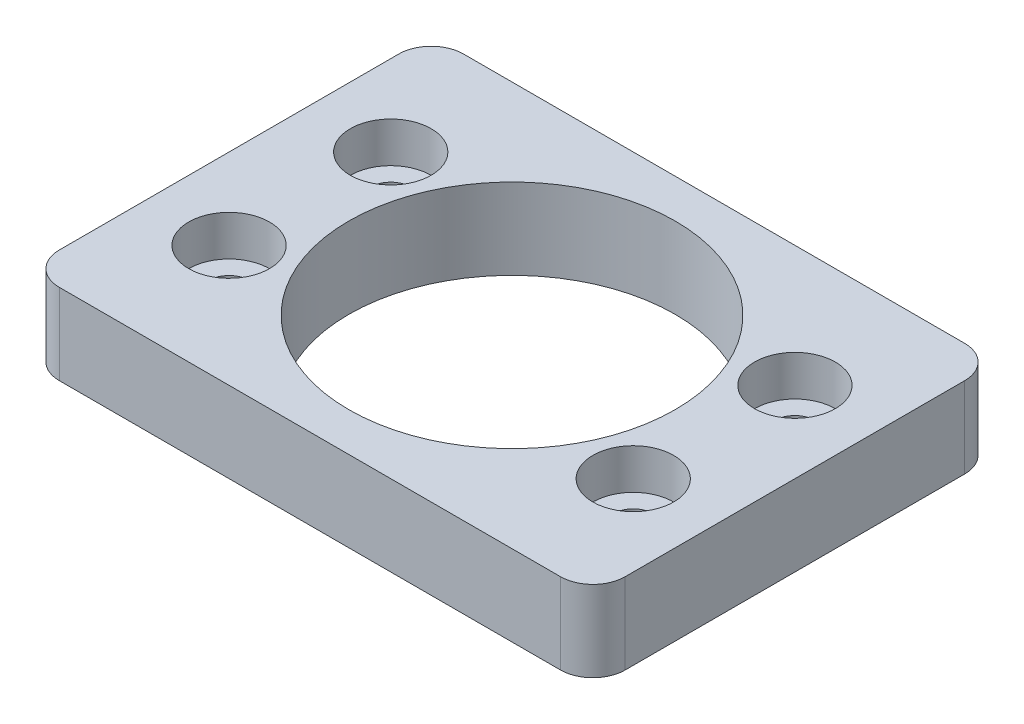
from build123d import *

# Parameters (mm, degrees)
SKETCH1_W           = 88.9
SKETCH1_H           = 63.5
SKETCH1_R           = 25.654
SKETCH1_R_2         = 3.175
BOSS_EXTRUDE1_DEPTH = 12.7
FILLET1_R           = 5.08
SKETCH2_R           = 6.35
CUT_EXTRUDE1_DEPTH  = 6.35


with BuildPart() as part:
    # Sketch1 → Boss-Extrude1 (new body)
    with BuildSketch(Plane(origin=(0, 0, 0), x_dir=(1, 0, 0), z_dir=(0, 1, 0))):
        Rectangle(SKETCH1_W, SKETCH1_H)
        with Locations(Location((0, 0, 0), (0, 0, 270))):
            Circle(SKETCH1_R, mode=Mode.SUBTRACT)
        with Locations(Location((-31.75, 12.7, 0), (0, 0, 270))):
            Circle(SKETCH1_R_2, mode=Mode.SUBTRACT)
        with Locations(Location((-31.75, -12.7, 0), (0, 0, 270))):
            Circle(SKETCH1_R_2, mode=Mode.SUBTRACT)
        with Locations(Location((31.75, -12.7, 0), (0, 0, 270))):
            Circle(SKETCH1_R_2, mode=Mode.SUBTRACT)
        with Locations(Location((31.75, 12.7, 0), (0, 0, 270))):
            Circle(SKETCH1_R_2, mode=Mode.SUBTRACT)
    extrude(amount=BOSS_EXTRUDE1_DEPTH)

    # Fillet1
    fillet1_edges = [part.edges().sort_by_distance(p)[0] for p in [
        (44.45, 6.35, 31.75),
        (-44.45, 6.35, 31.75),
        (-44.45, 6.35, -31.75),
        (44.45, 6.35, -31.75),
    ]]
    fillet(fillet1_edges, radius=FILLET1_R)

    # Sketch2 → Cut-Extrude1 (cut)
    with BuildSketch(Plane(origin=(0, 12.7, 0), x_dir=(1, 0, 0), z_dir=(0, 1, 0))):
        with Locations(Location((-31.75, 12.7, 0), (0, 0, 270))):
            Circle(SKETCH2_R)
        with Locations(Location((-31.75, -12.7, 0), (0, 0, 270))):
            Circle(SKETCH2_R)
        with Locations(Location((31.75, -12.7, 0), (0, 0, 270))):
            Circle(SKETCH2_R)
        with Locations(Location((31.75, 12.7, 0), (0, 0, 270))):
            Circle(SKETCH2_R)
    extrude(amount=-CUT_EXTRUDE1_DEPTH, mode=Mode.SUBTRACT)


solid = part.part
